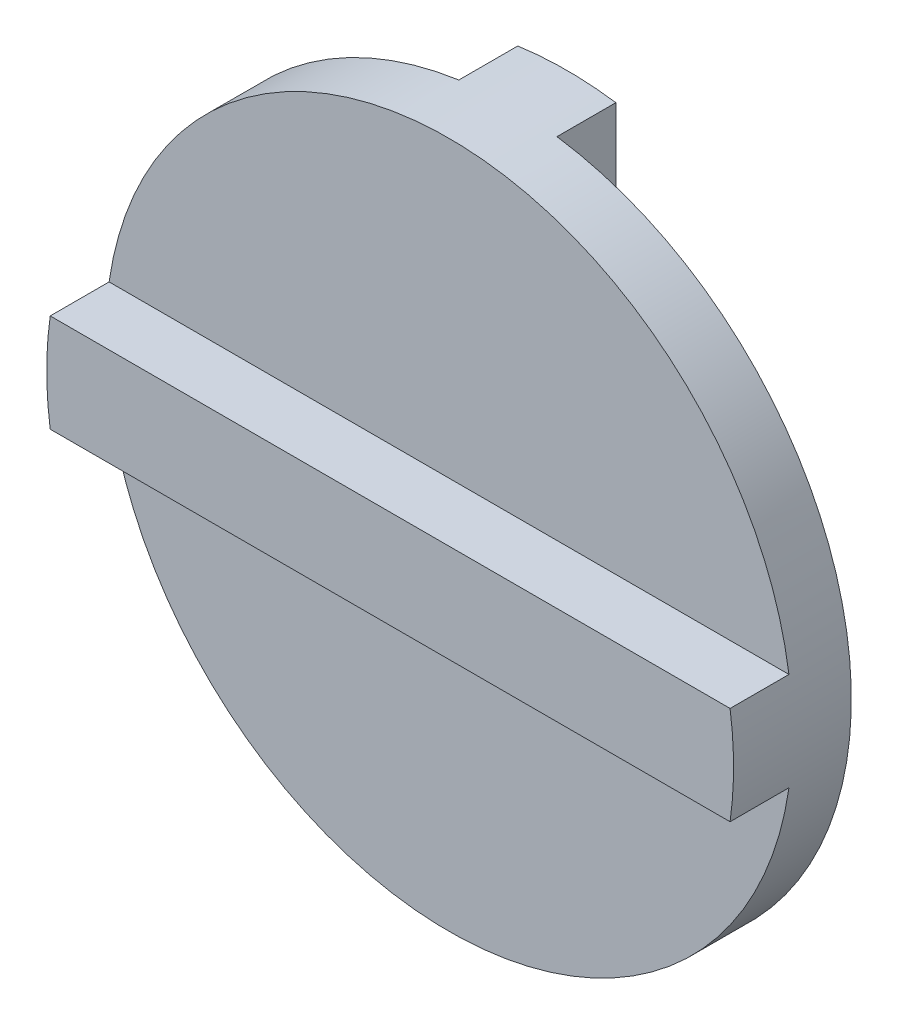
from build123d import *

# Parameters (mm, degrees)
SKETCH1_R           = 35
BOSS_EXTRUDE1_DEPTH = 3
BOSS_EXTRUDE2_START = 6
BOSS_EXTRUDE2_DEPTH = 6
BOSS_EXTRUDE3_DEPTH = 6


with BuildPart() as part:
    # Sketch1 → Boss-Extrude1 (new, symmetric)
    with BuildSketch(Plane.XY):
        Circle(SKETCH1_R)
    extrude(amount=BOSS_EXTRUDE1_DEPTH, both=True)

    # Sketch2 → Boss-Extrude2 (add)
    with BuildSketch(Plane.XY.offset(3).offset(BOSS_EXTRUDE2_START)):
        with BuildLine():
            Line((34.641016151, 5), (-34.641016151, 5))
            ThreePointArc((-34.641016151, 5), (-35, 0), (-34.641016151, -5))
            Line((-34.641016151, -5), (34.641016151, -5))
            ThreePointArc((34.641016151, -5), (35, 0), (34.641016151, 5))
        make_face()
    extrude(amount=-BOSS_EXTRUDE2_DEPTH)

    # Sketch3 → Boss-Extrude3 (add)
    with BuildSketch(Plane(origin=(0, 0, -3), x_dir=(-1, 0, 0), z_dir=(0, 0, -1))):
        with BuildLine():
            Line((5, -34.641016151), (5, 34.641016151))
            ThreePointArc((5, 34.641016151), (0, 35), (-5, 34.641016151))
            Line((-5, 34.641016151), (-5, -34.641016151))
            ThreePointArc((-5, -34.641016151), (0, -35), (5, -34.641016151))
        make_face()
    extrude(amount=BOSS_EXTRUDE3_DEPTH)


solid = part.part
